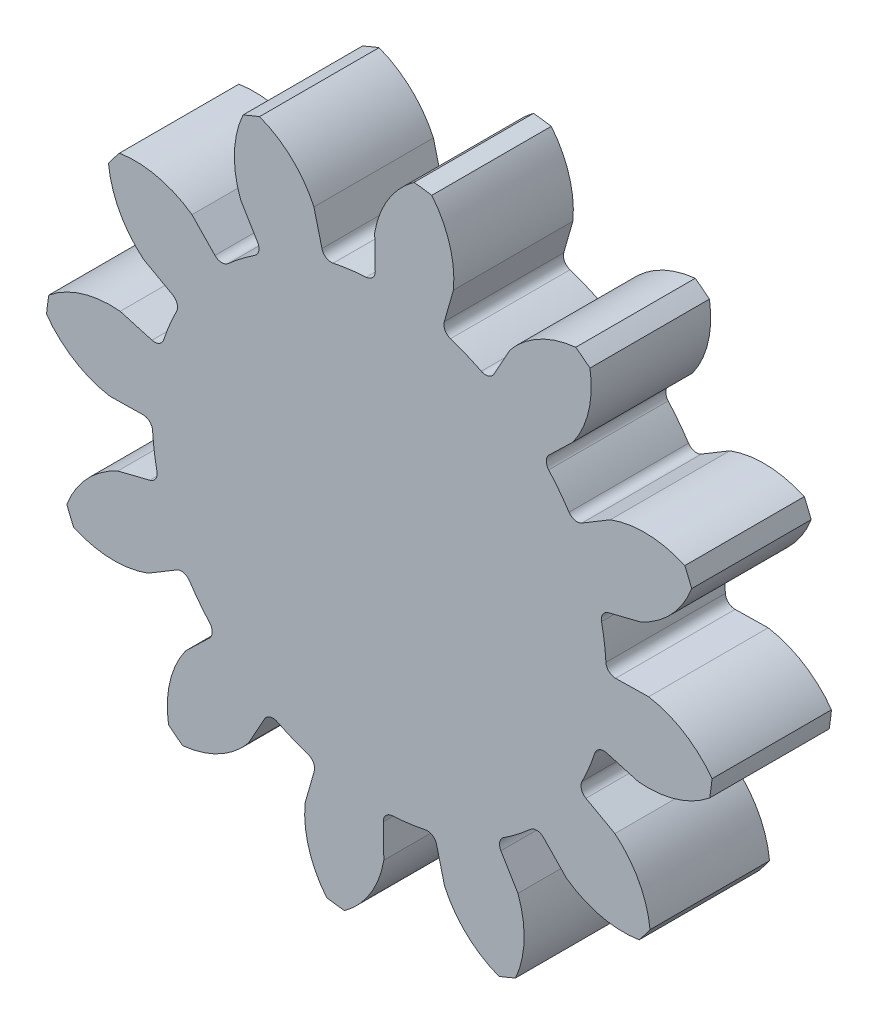
from build123d import *

# Parameters (mm, degrees)
EXTRUDE_1_DEPTH = 2.5


with BuildPart() as part:
    # 草图1 → 凸台-拉伸1 (new, symmetric)
    with BuildSketch(Plane.XY):
        with BuildLine():
            Line((-0.191056214, 11.274692786), (-0.167600195, 9.890495952))
            ThreePointArc((-0.167600195, 9.890495952), (-0.274389628, 9.61157676), (-0.544611756, 9.484376523))
            ThreePointArc((-0.544611756, 9.484376523), (-0.892908855, 9.457944479), (-1.239998826, 9.418726183))
            ThreePointArc((-1.239998826, 9.418726183), (-1.585412435, 9.366774654), (-1.928682715, 9.302160125))
            ThreePointArc((-1.928682715, 9.302160125), (-2.222619091, 9.355087486), (-2.397959361, 9.596863597))
            Line((-2.397959361, 9.596863597), (-2.733559089, 10.939965933))
            ThreePointArc((-2.733559089, 10.939965933), (-2.904788096, 11.274059763), (-3.105828541, 11.591109915))
            ThreePointArc((-3.105828541, 11.591109915), (-3.946075666, 12.47515697), (-5.009017132, 13.073245479))
            ThreePointArc((-5.009017132, 13.073245479), (-5.357568053, 12.934313455), (-5.702270549, 12.786090512))
            ThreePointArc((-5.702270549, 12.786090512), (-6.030971228, 11.611564953), (-6, 10.392304845))
            ThreePointArc((-6, 10.392304845), (-5.917968749, 10.02595947), (-5.802805928, 9.668642266))
            Line((-5.802805928, 9.668642266), (-5.090394003, 8.481620653))
            ThreePointArc((-5.090394003, 8.481620653), (-5.043416769, 8.186674831), (-5.213835877, 7.94140513))
            ThreePointArc((-5.213835877, 7.94140513), (-5.502253992, 7.744365759), (-5.783233576, 7.536856733))
            ThreePointArc((-5.783233576, 7.536856733), (-6.056394771, 7.319158584), (-6.321368289, 7.091565621))
            ThreePointArc((-6.321368289, 7.091565621), (-6.602388338, 6.990433872), (-6.875125522, 7.112147991))
            Line((-6.875125522, 7.112147991), (-7.837314581, 8.10750887))
            ThreePointArc((-7.837314581, 8.10750887), (-8.152650165, 8.31122811), (-8.485281374, 8.485281374))
            ThreePointArc((-8.485281374, 8.485281374), (-9.654980257, 8.83076502), (-10.874558824, 8.817254129))
            ThreePointArc((-10.874558824, 8.817254129), (-11.106946764, 8.522660006), (-11.331356411, 8.221943924))
            ThreePointArc((-11.331356411, 8.221943924), (-11.028756769, 7.040424613), (-10.392304845, 6))
            ThreePointArc((-10.392304845, 6), (-10.138091011, 5.723751224), (-9.85969848, 5.471886858))
            Line((-9.85969848, 5.471886858), (-8.649220848, 4.800101949))
            ThreePointArc((-8.649220848, 4.800101949), (-8.461064459, 4.568159992), (-8.486016886, 4.270540646))
            ThreePointArc((-8.486016886, 4.270540646), (-8.637274614, 3.955690488), (-8.776855559, 3.635492607))
            ThreePointArc((-8.776855559, 3.635492607), (-8.904571019, 3.310379883), (-9.020248336, 2.980791835))
            ThreePointArc((-9.020248336, 2.980791835), (-9.213052963, 2.752699147), (-9.510107352, 2.721738075))
            Line((-9.510107352, 2.721738075), (-10.841067959, 3.102651352))
            ThreePointArc((-10.841067959, 3.102651352), (-11.216016206, 3.121409598), (-11.591109915, 3.105828541))
            ThreePointArc((-11.591109915, 3.105828541), (-12.776840686, 2.820176713), (-13.826271261, 2.198686655))
            ThreePointArc((-13.826271261, 2.198686655), (-13.880228059, 1.827366691), (-13.924214473, 1.454734101))
            ThreePointArc((-13.924214473, 1.454734101), (-13.07139584, 0.582808184), (-12, 0))
            ThreePointArc((-12, 0), (-11.641719973, -0.11213154), (-11.274692786, -0.191056214))
            Line((-11.274692786, -0.191056214), (-9.890495952, -0.167600195))
            ThreePointArc((-9.890495952, -0.167600195), (-9.61157676, -0.274389628), (-9.484376523, -0.544611756))
            ThreePointArc((-9.484376523, -0.544611756), (-9.457944479, -0.892908855), (-9.418726183, -1.239998826))
            ThreePointArc((-9.418726183, -1.239998826), (-9.366774654, -1.585412435), (-9.302160125, -1.928682715))
            ThreePointArc((-9.302160125, -1.928682715), (-9.355087486, -2.222619091), (-9.596863597, -2.397959361))
            Line((-9.596863597, -2.397959361), (-10.939965933, -2.733559089))
            ThreePointArc((-10.939965933, -2.733559089), (-11.274059763, -2.904788096), (-11.591109915, -3.105828541))
            ThreePointArc((-11.591109915, -3.105828541), (-12.47515697, -3.946075666), (-13.073245479, -5.009017132))
            ThreePointArc((-13.073245479, -5.009017132), (-12.934313455, -5.357568053), (-12.786090512, -5.702270549))
            ThreePointArc((-12.786090512, -5.702270549), (-11.611564953, -6.030971228), (-10.392304845, -6))
            ThreePointArc((-10.392304845, -6), (-10.02595947, -5.917968749), (-9.668642266, -5.802805928))
            Line((-9.668642266, -5.802805928), (-8.481620653, -5.090394003))
            ThreePointArc((-8.481620653, -5.090394003), (-8.186674831, -5.043416769), (-7.94140513, -5.213835877))
            ThreePointArc((-7.94140513, -5.213835877), (-7.744365759, -5.502253992), (-7.536856733, -5.783233576))
            ThreePointArc((-7.536856733, -5.783233576), (-7.319158584, -6.056394771), (-7.091565621, -6.321368289))
            ThreePointArc((-7.091565621, -6.321368289), (-6.990433872, -6.602388338), (-7.112147991, -6.875125522))
            Line((-7.112147991, -6.875125522), (-8.10750887, -7.837314581))
            ThreePointArc((-8.10750887, -7.837314581), (-8.31122811, -8.152650165), (-8.485281374, -8.485281374))
            ThreePointArc((-8.485281374, -8.485281374), (-8.83076502, -9.654980257), (-8.817254129, -10.874558824))
            ThreePointArc((-8.817254129, -10.874558824), (-8.522660006, -11.106946764), (-8.221943924, -11.331356411))
            ThreePointArc((-8.221943924, -11.331356411), (-7.040424613, -11.028756769), (-6, -10.392304845))
            ThreePointArc((-6, -10.392304845), (-5.723751224, -10.138091011), (-5.471886858, -9.85969848))
            Line((-5.471886858, -9.85969848), (-4.800101949, -8.649220848))
            ThreePointArc((-4.800101949, -8.649220848), (-4.568159992, -8.461064459), (-4.270540646, -8.486016886))
            ThreePointArc((-4.270540646, -8.486016886), (-3.955690488, -8.637274614), (-3.635492607, -8.776855559))
            ThreePointArc((-3.635492607, -8.776855559), (-3.310379883, -8.904571019), (-2.980791835, -9.020248336))
            ThreePointArc((-2.980791835, -9.020248336), (-2.752699147, -9.213052963), (-2.721738075, -9.510107352))
            Line((-2.721738075, -9.510107352), (-3.102651352, -10.841067959))
            ThreePointArc((-3.102651352, -10.841067959), (-3.121409598, -11.216016206), (-3.105828541, -11.591109915))
            ThreePointArc((-3.105828541, -11.591109915), (-2.820176713, -12.776840686), (-2.198686655, -13.826271261))
            ThreePointArc((-2.198686655, -13.826271261), (-1.827366691, -13.880228059), (-1.454734101, -13.924214473))
            ThreePointArc((-1.454734101, -13.924214473), (-0.582808184, -13.07139584), (0, -12))
            ThreePointArc((0, -12), (0.11213154, -11.641719973), (0.191056214, -11.274692786))
            Line((0.191056214, -11.274692786), (0.167600195, -9.890495952))
            ThreePointArc((0.167600195, -9.890495952), (0.274389628, -9.61157676), (0.544611756, -9.484376523))
            ThreePointArc((0.544611756, -9.484376523), (0.892908855, -9.457944479), (1.239998826, -9.418726183))
            ThreePointArc((1.239998826, -9.418726183), (1.585412435, -9.366774654), (1.928682715, -9.302160125))
            ThreePointArc((1.928682715, -9.302160125), (2.222619091, -9.355087486), (2.397959361, -9.596863597))
            Line((2.397959361, -9.596863597), (2.733559089, -10.939965933))
            ThreePointArc((2.733559089, -10.939965933), (2.904788096, -11.274059763), (3.105828541, -11.591109915))
            ThreePointArc((3.105828541, -11.591109915), (3.946075666, -12.47515697), (5.009017132, -13.073245479))
            ThreePointArc((5.009017132, -13.073245479), (5.357568053, -12.934313455), (5.702270549, -12.786090512))
            ThreePointArc((5.702270549, -12.786090512), (6.030971228, -11.611564953), (6, -10.392304845))
            ThreePointArc((6, -10.392304845), (5.917968749, -10.02595947), (5.802805928, -9.668642266))
            Line((5.802805928, -9.668642266), (5.090394003, -8.481620653))
            ThreePointArc((5.090394003, -8.481620653), (5.043416769, -8.186674831), (5.213835877, -7.94140513))
            ThreePointArc((5.213835877, -7.94140513), (5.502253992, -7.744365759), (5.783233576, -7.536856733))
            ThreePointArc((5.783233576, -7.536856733), (6.056394771, -7.319158584), (6.321368289, -7.091565621))
            ThreePointArc((6.321368289, -7.091565621), (6.602388338, -6.990433872), (6.875125522, -7.112147991))
            Line((6.875125522, -7.112147991), (7.837314581, -8.10750887))
            ThreePointArc((7.837314581, -8.10750887), (8.152650165, -8.31122811), (8.485281374, -8.485281374))
            ThreePointArc((8.485281374, -8.485281374), (9.654980257, -8.83076502), (10.874558824, -8.817254129))
            ThreePointArc((10.874558824, -8.817254129), (11.106946764, -8.522660006), (11.331356411, -8.221943924))
            ThreePointArc((11.331356411, -8.221943924), (11.028756769, -7.040424613), (10.392304845, -6))
            ThreePointArc((10.392304845, -6), (10.138091011, -5.723751224), (9.85969848, -5.471886858))
            Line((9.85969848, -5.471886858), (8.649220848, -4.800101949))
            ThreePointArc((8.649220848, -4.800101949), (8.461064459, -4.568159992), (8.486016886, -4.270540646))
            ThreePointArc((8.486016886, -4.270540646), (8.637274614, -3.955690488), (8.776855559, -3.635492607))
            ThreePointArc((8.776855559, -3.635492607), (8.904571019, -3.310379883), (9.020248336, -2.980791835))
            ThreePointArc((9.020248336, -2.980791835), (9.213052963, -2.752699147), (9.510107352, -2.721738075))
            Line((9.510107352, -2.721738075), (10.841067959, -3.102651352))
            ThreePointArc((10.841067959, -3.102651352), (11.216016206, -3.121409598), (11.591109915, -3.105828541))
            ThreePointArc((11.591109915, -3.105828541), (12.776840686, -2.820176713), (13.826271261, -2.198686655))
            ThreePointArc((13.826271261, -2.198686655), (13.880228059, -1.827366691), (13.924214473, -1.454734101))
            ThreePointArc((13.924214473, -1.454734101), (13.07139584, -0.582808184), (12, 0))
            ThreePointArc((12, 0), (11.641719973, 0.11213154), (11.274692786, 0.191056214))
            Line((11.274692786, 0.191056214), (9.890495952, 0.167600195))
            ThreePointArc((9.890495952, 0.167600195), (9.61157676, 0.274389628), (9.484376523, 0.544611756))
            ThreePointArc((9.484376523, 0.544611756), (9.457944479, 0.892908855), (9.418726183, 1.239998826))
            ThreePointArc((9.418726183, 1.239998826), (9.366774654, 1.585412435), (9.302160125, 1.928682715))
            ThreePointArc((9.302160125, 1.928682715), (9.355087486, 2.222619091), (9.596863597, 2.397959361))
            Line((9.596863597, 2.397959361), (10.939965933, 2.733559089))
            ThreePointArc((10.939965933, 2.733559089), (11.274059763, 2.904788096), (11.591109915, 3.105828541))
            ThreePointArc((11.591109915, 3.105828541), (12.47515697, 3.946075666), (13.073245479, 5.009017132))
            ThreePointArc((13.073245479, 5.009017132), (12.934313455, 5.357568053), (12.786090512, 5.702270549))
            ThreePointArc((12.786090512, 5.702270549), (11.611564953, 6.030971228), (10.392304845, 6))
            ThreePointArc((10.392304845, 6), (10.02595947, 5.917968749), (9.668642266, 5.802805928))
            Line((9.668642266, 5.802805928), (8.481620653, 5.090394003))
            ThreePointArc((8.481620653, 5.090394003), (8.186674831, 5.043416769), (7.94140513, 5.213835877))
            ThreePointArc((7.94140513, 5.213835877), (7.744365759, 5.502253992), (7.536856733, 5.783233576))
            ThreePointArc((7.536856733, 5.783233576), (7.319158584, 6.056394771), (7.091565621, 6.321368289))
            ThreePointArc((7.091565621, 6.321368289), (6.990433872, 6.602388338), (7.112147991, 6.875125522))
            Line((7.112147991, 6.875125522), (8.10750887, 7.837314581))
            ThreePointArc((8.10750887, 7.837314581), (8.31122811, 8.152650165), (8.485281374, 8.485281374))
            ThreePointArc((8.485281374, 8.485281374), (8.83076502, 9.654980257), (8.817254129, 10.874558824))
            ThreePointArc((8.817254129, 10.874558824), (8.522660006, 11.106946764), (8.221943924, 11.331356411))
            ThreePointArc((8.221943924, 11.331356411), (7.040424613, 11.028756769), (6, 10.392304845))
            ThreePointArc((6, 10.392304845), (5.723751224, 10.138091011), (5.471886858, 9.85969848))
            Line((5.471886858, 9.85969848), (4.800101949, 8.649220848))
            ThreePointArc((4.800101949, 8.649220848), (4.568159992, 8.461064459), (4.270540646, 8.486016886))
            ThreePointArc((4.270540646, 8.486016886), (3.955690488, 8.637274614), (3.635492607, 8.776855559))
            ThreePointArc((3.635492607, 8.776855559), (3.310379883, 8.904571019), (2.980791835, 9.020248336))
            ThreePointArc((2.980791835, 9.020248336), (2.752699147, 9.213052963), (2.721738075, 9.510107352))
            Line((2.721738075, 9.510107352), (3.102651352, 10.841067959))
            ThreePointArc((3.102651352, 10.841067959), (3.121409598, 11.216016206), (3.105828541, 11.591109915))
            ThreePointArc((3.105828541, 11.591109915), (2.820176713, 12.776840686), (2.198686655, 13.826271261))
            ThreePointArc((2.198686655, 13.826271261), (1.827366691, 13.880228059), (1.454734101, 13.924214473))
            ThreePointArc((1.454734101, 13.924214473), (0.582808184, 13.07139584), (0, 12))
            ThreePointArc((0, 12), (-0.11213154, 11.641719973), (-0.191056214, 11.274692786))
        make_face()
    extrude(amount=EXTRUDE_1_DEPTH, both=True)


solid = part.part
